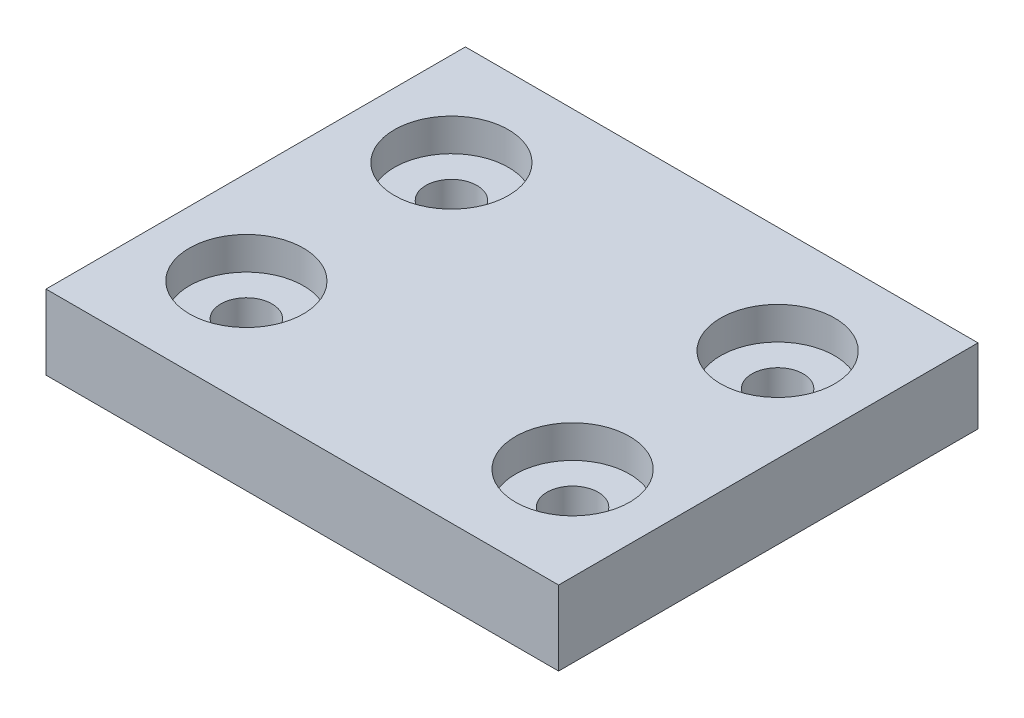
from build123d import *

# Parameters (mm, degrees)
SKETCH1_W                                    = 55
SKETCH1_H                                    = 45
BOSS_EXTRUDE1_DEPTH                          = 8
CBORE_FOR_M5_HEX_HEAD_CAP_SCREW1_D           = 5.5
CBORE_FOR_M5_HEX_HEAD_CAP_SCREW1_CBORE_D     = 12.238
CBORE_FOR_M5_HEX_HEAD_CAP_SCREW1_CBORE_DEPTH = 3.5


with BuildPart() as part:
    # Sketch1 → Boss-Extrude1 (new body)
    with BuildSketch(Plane(origin=(0, 0, 0), x_dir=(1, 0, 0), z_dir=(0, 1, 0))):
        Rectangle(SKETCH1_W, SKETCH1_H)
    extrude(amount=BOSS_EXTRUDE1_DEPTH)

    # CBORE for M5 Hex Head Cap Screw1 (through all)
    with Locations(Plane(origin=(0, 8, 0), x_dir=(1, 0, 0), z_dir=(0, 1, 0))):
        with Locations((-17.5, 11), (17.5, 11), (17.5, -11), (-17.5, -11)):
            CounterBoreHole(CBORE_FOR_M5_HEX_HEAD_CAP_SCREW1_D / 2, CBORE_FOR_M5_HEX_HEAD_CAP_SCREW1_CBORE_D / 2, CBORE_FOR_M5_HEX_HEAD_CAP_SCREW1_CBORE_DEPTH)


solid = part.part
